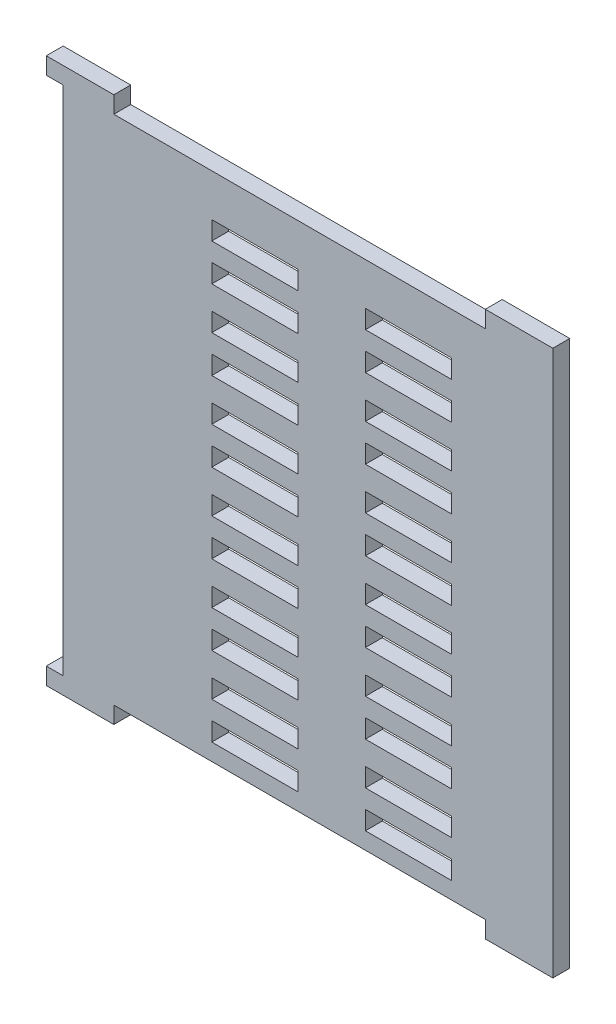
from build123d import *

# Parameters (mm, degrees)
SKETCH1_W           = 25.5
SKETCH1_H           = 5.5
BOSS_EXTRUDE1_DEPTH = 5


with BuildPart() as part:
    # Sketch1 → Boss-Extrude1 (new body)
    with BuildSketch(Plane.XY):
        Polygon((-100, 151.5), (-100, 146.5), (10, 146.5), (10, 151.5), (30, 151.5), (30, -10), (10, -10), (10, -5), (-100, -5), (-100, -10), (-120, -10), (-120, -5), (-115, -5), (-115, 146.5), (-120, 146.5), (-120, 151.5), align=None)
        with Locations((-58.25, 13.75)):
            Rectangle(SKETCH1_W, SKETCH1_H, mode=Mode.SUBTRACT)
        with Locations((-12.75, 2.75)):
            Rectangle(SKETCH1_W, SKETCH1_H, mode=Mode.SUBTRACT)
        with Locations((-58.25, 2.75)):
            Rectangle(SKETCH1_W, SKETCH1_H, mode=Mode.SUBTRACT)
        with Locations((-12.75, 13.75)):
            Rectangle(SKETCH1_W, SKETCH1_H, mode=Mode.SUBTRACT)
        with Locations((-12.75, 26.25)):
            Rectangle(SKETCH1_W, SKETCH1_H, mode=Mode.SUBTRACT)
        with Locations((-58.25, 26.25)):
            Rectangle(SKETCH1_W, SKETCH1_H, mode=Mode.SUBTRACT)
        with Locations((-58.25, 37.25)):
            Rectangle(SKETCH1_W, SKETCH1_H, mode=Mode.SUBTRACT)
        with Locations((-12.75, 37.25)):
            Rectangle(SKETCH1_W, SKETCH1_H, mode=Mode.SUBTRACT)
        with Locations((-12.75, 49.75)):
            Rectangle(SKETCH1_W, SKETCH1_H, mode=Mode.SUBTRACT)
        with Locations((-58.25, 49.75)):
            Rectangle(SKETCH1_W, SKETCH1_H, mode=Mode.SUBTRACT)
        with Locations((-58.25, 60.75)):
            Rectangle(SKETCH1_W, SKETCH1_H, mode=Mode.SUBTRACT)
        with Locations((-12.75, 60.75)):
            Rectangle(SKETCH1_W, SKETCH1_H, mode=Mode.SUBTRACT)
        with Locations((-12.75, 73.25)):
            Rectangle(SKETCH1_W, SKETCH1_H, mode=Mode.SUBTRACT)
        with Locations((-58.25, 73.25)):
            Rectangle(SKETCH1_W, SKETCH1_H, mode=Mode.SUBTRACT)
        with Locations((-58.25, 84.25)):
            Rectangle(SKETCH1_W, SKETCH1_H, mode=Mode.SUBTRACT)
        with Locations((-12.75, 84.25)):
            Rectangle(SKETCH1_W, SKETCH1_H, mode=Mode.SUBTRACT)
        with Locations((-12.75, 96.75)):
            Rectangle(SKETCH1_W, SKETCH1_H, mode=Mode.SUBTRACT)
        with Locations((-58.25, 96.75)):
            Rectangle(SKETCH1_W, SKETCH1_H, mode=Mode.SUBTRACT)
        with Locations((-58.25, 107.75)):
            Rectangle(SKETCH1_W, SKETCH1_H, mode=Mode.SUBTRACT)
        with Locations((-12.75, 107.75)):
            Rectangle(SKETCH1_W, SKETCH1_H, mode=Mode.SUBTRACT)
        with Locations((-12.75, 120.25)):
            Rectangle(SKETCH1_W, SKETCH1_H, mode=Mode.SUBTRACT)
        with Locations((-58.25, 120.25)):
            Rectangle(SKETCH1_W, SKETCH1_H, mode=Mode.SUBTRACT)
        with Locations((-58.25, 131.25)):
            Rectangle(SKETCH1_W, SKETCH1_H, mode=Mode.SUBTRACT)
        with Locations((-12.75, 131.25)):
            Rectangle(SKETCH1_W, SKETCH1_H, mode=Mode.SUBTRACT)
    extrude(amount=BOSS_EXTRUDE1_DEPTH)


solid = part.part
